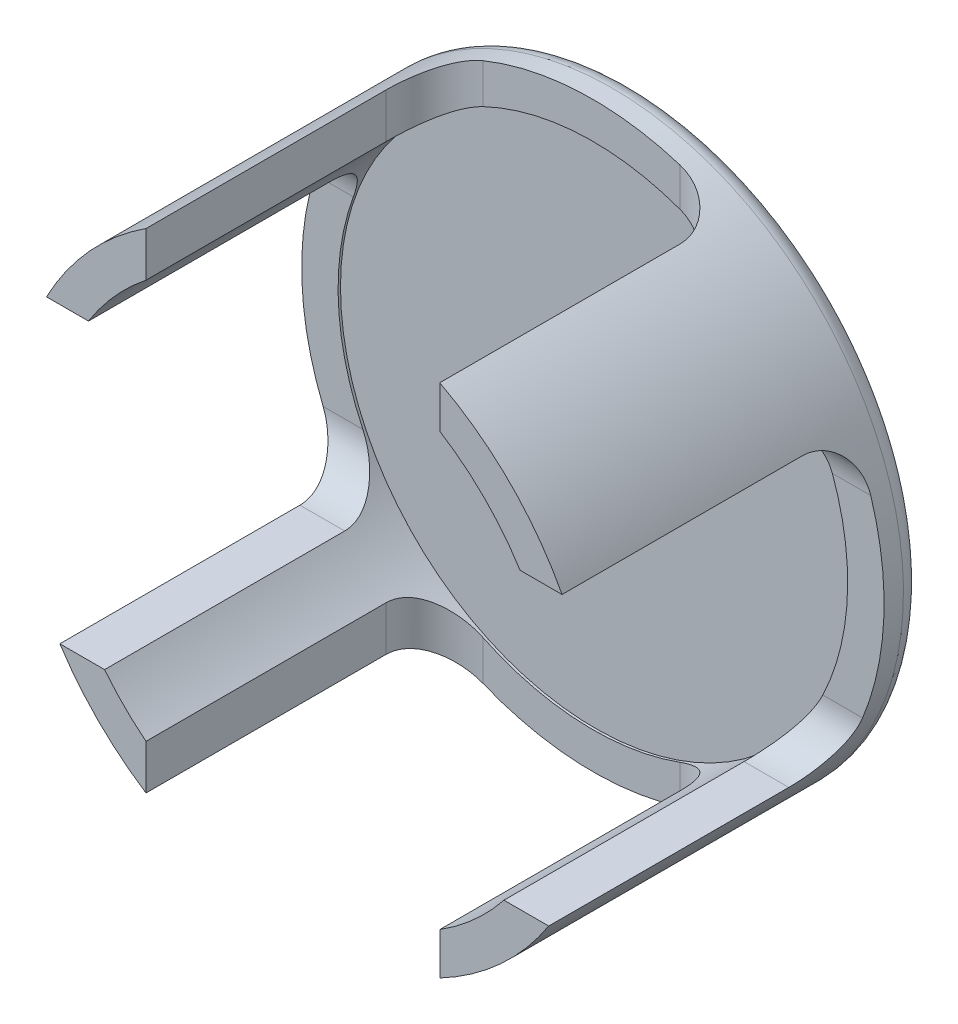
from build123d import *

# Parameters (mm, degrees)
BOSS_EXTRUDE1_DEPTH      = 1
BOSS_EXTRUDE1_DEPTH_BACK = 5.746
SKETCH2_R                = 6
SHELL1_T                 = -0.75
SKETCH3_W                = 5.946271115
SKETCH3_H                = 6.052851553
CUT_EXTRUDE1_DEPTH       = 40.659561396
FILLET1_R                = 1
CIRPATTERN1_COUNT        = 2
CIRPATTERN1_ANGLE        = 90
FILLET1_OF_CIRPATTERN1_R = 1
FILLET2_R                = 0.4


with BuildPart() as part:
    # Sketch2 → Boss-Extrude1 (new, two sides: drawn at the far end of the back side and taken through both)
    with BuildSketch(Plane(origin=(0, 0, 4.668), x_dir=(-1, 0, 0), z_dir=(0, 0, -1)).offset(-BOSS_EXTRUDE1_DEPTH_BACK)):
        with Locations((-0.092980153, 31.779690403)):
            Circle(SKETCH2_R)
    extrude(amount=BOSS_EXTRUDE1_DEPTH + BOSS_EXTRUDE1_DEPTH_BACK)

    # Shell1
    shell1_openings = [part.faces().sort_by_distance(p)[0] for p in [
        (0.092980153, 31.779690403, 10.414),
    ]]
    offset(amount=SHELL1_T, openings=shell1_openings, kind=Kind.INTERSECTION)

    # Sketch3 → Cut-Extrude1 (cut, symmetric)
    with BuildSketch(Plane(origin=(0, 0, 0), x_dir=(0, 0, -1), z_dir=(1, 0, 0))):
        with Locations((-7.440864443, 31.545021025)):
            Rectangle(SKETCH3_W, SKETCH3_H)
    cut_extrude1 = extrude(amount=CUT_EXTRUDE1_DEPTH, both=True, mode=Mode.SUBTRACT)

    # Fillet1
    fillet1_edges = [part.edges().sort_by_distance(p)[0] for p in [
        (4.97154522, 34.571446801, 4.467728885),
        (-4.785584914, 34.571446801, 4.467728885),
        (4.668344707, 28.518595248, 4.467728885),
        (-4.482384401, 28.518595248, 4.467728885),
    ]]
    fillet(fillet1_edges, radius=FILLET1_R)

    # CirPattern1: Cut-Extrude1 ×2 about axis
    cirpattern1_axis = Axis((0.092980153, 31.779690403, 10.414), (0, 0, -1))
    for i in range(1, CIRPATTERN1_COUNT):
        add(cut_extrude1.rotate(cirpattern1_axis, i * CIRPATTERN1_ANGLE / (CIRPATTERN1_COUNT - 1)), mode=Mode.SUBTRACT)

    # Fillet1 of CirPattern1
    fillet1_of_cirpattern1_edges = [part.edges().sort_by_distance(p)[0] for p in [
        (2.884736551, 26.901125336, 4.467728885),
        (2.884736551, 36.65825547, 4.467728885),
        (-3.168115002, 27.204325849, 4.467728885),
        (-3.168115002, 36.355054957, 4.467728885),
    ]]
    fillet(fillet1_of_cirpattern1_edges, radius=FILLET1_OF_CIRPATTERN1_R)

    # Fillet2
    fillet2_edges = [part.edges().sort_by_distance(p)[0] for p in [
        (6.092980153, 31.779690403, 3.668),
    ]]
    fillet(fillet2_edges, radius=FILLET2_R)


solid = part.part
